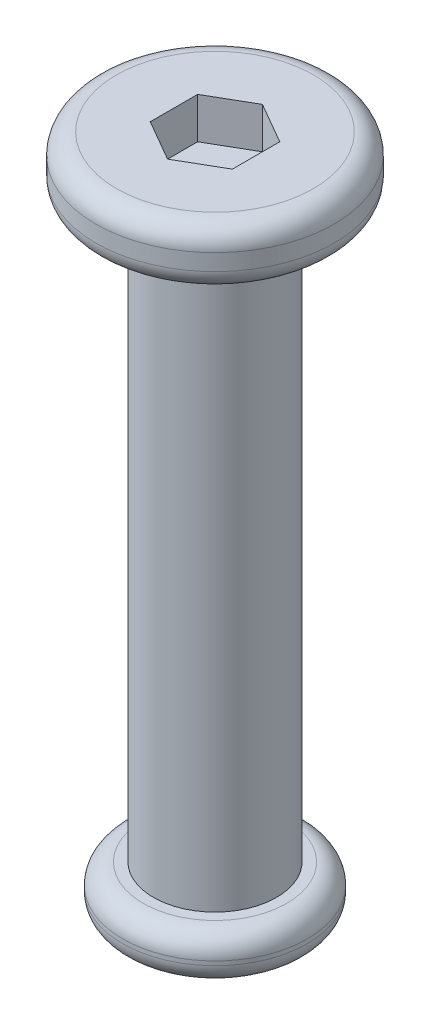
from build123d import *

# Parameters (mm, degrees)
SKETCH_1_R          = 2.9
EXTRUDE_1_DEPTH     = 1.4
CUT_EXTRUDE_1_DEPTH = 1
SKETCH_3_R          = 1.5
EXTRUDE_2_DEPTH     = 14
SKETCH_4_R          = 2.25
EXTRUDE_3_DEPTH     = 1.1
CUT_EXTRUDE_2_DEPTH = 0.8
FILLET_1_R          = 0.5


with BuildPart() as part:
    # 草图1 → 凸台-拉伸1 (new body)
    with BuildSketch(Plane(origin=(0, 0, 0), x_dir=(1, 0, 0), z_dir=(0, 1, 0))):
        with Locations(Location((0, 0, 0), (0, 0, 270))):
            Circle(SKETCH_1_R)
    extrude(amount=EXTRUDE_1_DEPTH)

    # 草图2 → 切除-拉伸1 (cut)
    with BuildSketch(Plane(origin=(0, 1.4, 0), x_dir=(1, 0, 0), z_dir=(0, 1, 0))):
        Polygon((1, 0.577350269), (0, 1.154700538), (-1, 0.577350269), (-1, -0.577350269), (0, -1.154700538), (1, -0.577350269), align=None)
    extrude(amount=-CUT_EXTRUDE_1_DEPTH, mode=Mode.SUBTRACT)

    # 草图3 → 凸台-拉伸2 (add)
    with BuildSketch(Plane.XZ):
        with Locations(Location((0, 0, 0), (0, 0, 270))):
            Circle(SKETCH_3_R)
    extrude(amount=EXTRUDE_2_DEPTH)

    # 草图4 → 凸台-拉伸3 (add)
    with BuildSketch(Plane.XZ.offset(14)):
        with Locations(Location((0, 0, 0), (0, 0, 270))):
            Circle(SKETCH_4_R)
    extrude(amount=EXTRUDE_3_DEPTH)

    # 草图5 → 切除-拉伸2 (cut)
    with BuildSketch(Plane.XZ.offset(15.1)):
        Polygon((0.65, 0.375277675), (0, 0.75055535), (-0.65, 0.375277675), (-0.65, -0.375277675), (0, -0.75055535), (0.65, -0.375277675), align=None)
    extrude(amount=-CUT_EXTRUDE_2_DEPTH, mode=Mode.SUBTRACT)

    # 圆角1
    fillet_1_edges = [part.edges().sort_by_distance(p)[0] for p in [
        (0, 0, -2.9),
        (0, -14, 2.25),
        (0, -15.1, 2.25),
        (0, 1.4, -2.9),
    ]]
    fillet(fillet_1_edges, radius=FILLET_1_R)


solid = part.part
